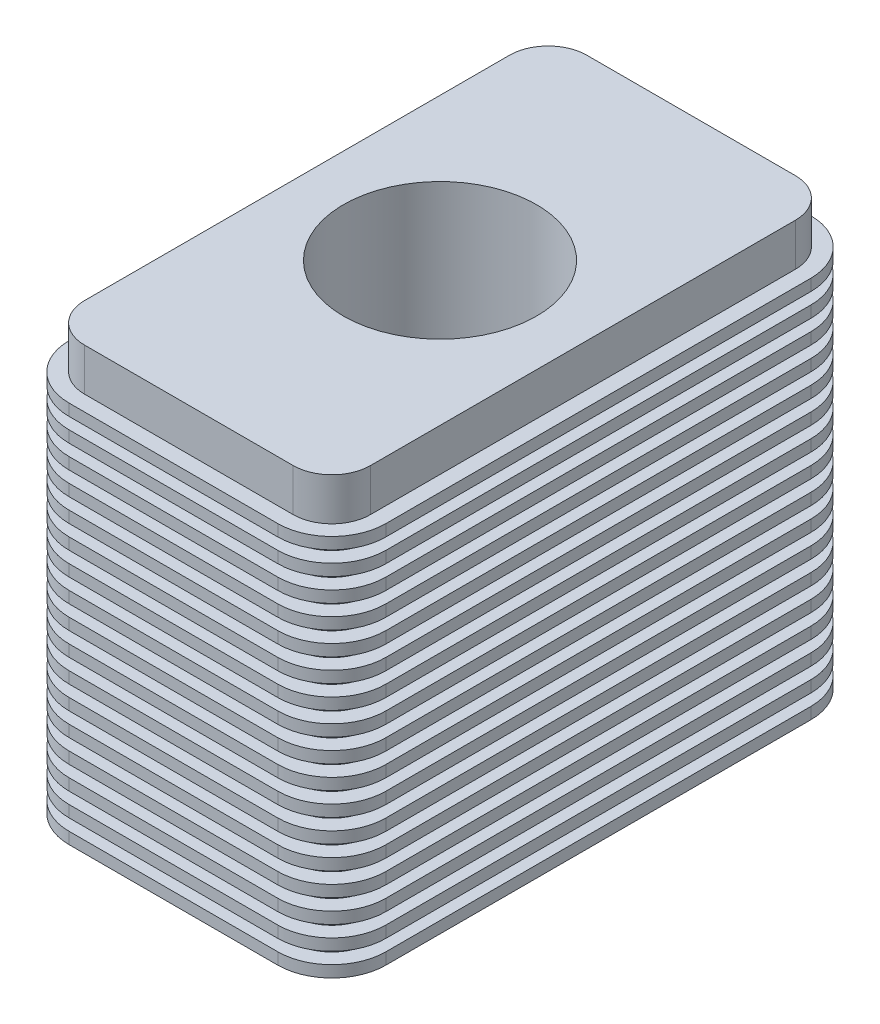
from build123d import *
from build123d.topology import SkipClean

# Parameters (mm, degrees)
BOSS_EXTRUDE1_DEPTH   = 110
BOSS_EXTRUDE3_DEPTH   = 3
LPATTERN1_COUNT       = 17
LPATTERN1_PITCH       = 6
MIRROR1_COPY_1_DEPTH  = 3
MIRROR1_COPY_2_DEPTH  = 3
MIRROR1_COPY_3_DEPTH  = 3
MIRROR1_COPY_4_DEPTH  = 3
MIRROR1_COPY_5_DEPTH  = 3
MIRROR1_COPY_6_DEPTH  = 3
MIRROR1_COPY_7_DEPTH  = 3
MIRROR1_COPY_8_DEPTH  = 3
MIRROR1_COPY_9_DEPTH  = 3
MIRROR1_COPY_10_DEPTH = 3
MIRROR1_COPY_11_DEPTH = 3
MIRROR1_COPY_12_DEPTH = 3
MIRROR1_COPY_13_DEPTH = 3
MIRROR1_COPY_14_DEPTH = 3
MIRROR1_COPY_15_DEPTH = 3
MIRROR1_COPY_16_DEPTH = 3


with BuildPart() as part:
    # Sketch1 → Boss-Extrude1 (new body)
    with BuildSketch(Plane(origin=(0, 0, 0), x_dir=(1, 0, 0), z_dir=(0, 1, 0))):
        with BuildLine():
            Line((25, 0), (37, 0))
            Line((37, 0), (37, 55))
            ThreePointArc((37, 55), (34.071067812, 62.071067812), (27, 65))
            Line((27, 65), (-27, 65))
            ThreePointArc((-27, 65), (-34.071067812, 62.071067812), (-37, 55))
            Line((-37, 55), (-37, 0))
            Line((-37, 0), (-25, 0))
            ThreePointArc((-25, 0), (0, 25), (25, 0))
        make_face()
    boss_extrude1 = extrude(amount=BOSS_EXTRUDE1_DEPTH)


with BuildPart() as body_2:
    # Sketch3 → Boss-Extrude3 (new body)
    with BuildSketch(Plane(origin=(0, 0, 0), x_dir=(-1, 0, 0), z_dir=(0, -1, 0))):
        with BuildLine():
            Line((27, 69), (-27, 69))
            ThreePointArc((-27, 69), (-36.899494937, 64.899494937), (-41, 55))
            Line((-41, 55), (-41, 0))
            Line((-41, 0), (-37, 0))
            Line((-37, 0), (-37, 55))
            ThreePointArc((-37, 55), (-34.071067812, 62.071067812), (-27, 65))
            Line((-27, 65), (27, 65))
            ThreePointArc((27, 65), (34.071067812, 62.071067812), (37, 55))
            Line((37, 55), (37, 0))
            Line((37, 0), (41, 0))
            Line((41, 0), (41, 55))
            ThreePointArc((41, 55), (36.899494937, 64.899494937), (27, 69))
        make_face()
    boss_extrude3 = extrude(amount=-BOSS_EXTRUDE3_DEPTH)


    with SkipClean():  # the faces are left unmerged after this step: merging them gives an invalid solid
        add(part.part)  # Mirror1 merges part
        # Mirror1: Boss-Extrude1, Boss-Extrude3 across plane
        add(boss_extrude1.mirror(Plane.XY))
        add(boss_extrude3.mirror(Plane.XY))



with BuildPart() as lpattern1_1:
    # LPattern1: pattern copy
    add(boss_extrude3.moved(Location(Vector(0, 1, 0) * (1 * LPATTERN1_PITCH))))


with BuildPart() as lpattern1_2:
    # LPattern1: pattern copy
    add(boss_extrude3.moved(Location(Vector(0, 1, 0) * (2 * LPATTERN1_PITCH))))


with BuildPart() as lpattern1_3:
    # LPattern1: pattern copy
    add(boss_extrude3.moved(Location(Vector(0, 1, 0) * (3 * LPATTERN1_PITCH))))


with BuildPart() as lpattern1_4:
    # LPattern1: pattern copy
    add(boss_extrude3.moved(Location(Vector(0, 1, 0) * (4 * LPATTERN1_PITCH))))


with BuildPart() as lpattern1_5:
    # LPattern1: pattern copy
    add(boss_extrude3.moved(Location(Vector(0, 1, 0) * (5 * LPATTERN1_PITCH))))


with BuildPart() as lpattern1_6:
    # LPattern1: pattern copy
    add(boss_extrude3.moved(Location(Vector(0, 1, 0) * (6 * LPATTERN1_PITCH))))


with BuildPart() as lpattern1_7:
    # LPattern1: pattern copy
    add(boss_extrude3.moved(Location(Vector(0, 1, 0) * (7 * LPATTERN1_PITCH))))


with BuildPart() as lpattern1_8:
    # LPattern1: pattern copy
    add(boss_extrude3.moved(Location(Vector(0, 1, 0) * (8 * LPATTERN1_PITCH))))


with BuildPart() as lpattern1_9:
    # LPattern1: pattern copy
    add(boss_extrude3.moved(Location(Vector(0, 1, 0) * (9 * LPATTERN1_PITCH))))


with BuildPart() as lpattern1_10:
    # LPattern1: pattern copy
    add(boss_extrude3.moved(Location(Vector(0, 1, 0) * (10 * LPATTERN1_PITCH))))


with BuildPart() as lpattern1_11:
    # LPattern1: pattern copy
    add(boss_extrude3.moved(Location(Vector(0, 1, 0) * (11 * LPATTERN1_PITCH))))


with BuildPart() as lpattern1_12:
    # LPattern1: pattern copy
    add(boss_extrude3.moved(Location(Vector(0, 1, 0) * (12 * LPATTERN1_PITCH))))


with BuildPart() as lpattern1_13:
    # LPattern1: pattern copy
    add(boss_extrude3.moved(Location(Vector(0, 1, 0) * (13 * LPATTERN1_PITCH))))


with BuildPart() as lpattern1_14:
    # LPattern1: pattern copy
    add(boss_extrude3.moved(Location(Vector(0, 1, 0) * (14 * LPATTERN1_PITCH))))


with BuildPart() as lpattern1_15:
    # LPattern1: pattern copy
    add(boss_extrude3.moved(Location(Vector(0, 1, 0) * (15 * LPATTERN1_PITCH))))


with BuildPart() as lpattern1_16:
    # LPattern1: pattern copy
    add(boss_extrude3.moved(Location(Vector(0, 1, 0) * (16 * LPATTERN1_PITCH))))


with BuildPart() as body_2_1:
    with SkipClean():  # the faces are left unmerged after this step: merging them gives an invalid solid
        add(body_2.part)

        add(lpattern1_1.part)  # Mirror1 copy 1 merges LPattern1_1
        # Mirror1 copy 1 sketch → Mirror1 copy 1 (add)
        with BuildSketch(Plane(origin=(0, 6, 0), x_dir=(-1, 0, 0), z_dir=(0, -1, 0))):
            with BuildLine():
                Line((27, -69), (-27, -69))
                ThreePointArc((-27, -69), (-36.899494937, -64.899494937), (-41, -55))
                Line((-41, -55), (-41, 0))
                Line((-41, 0), (-37, 0))
                Line((-37, 0), (-37, -55))
                ThreePointArc((-37, -55), (-34.071067812, -62.071067812), (-27, -65))
                Line((-27, -65), (27, -65))
                ThreePointArc((27, -65), (34.071067812, -62.071067812), (37, -55))
                Line((37, -55), (37, 0))
                Line((37, 0), (41, 0))
                Line((41, 0), (41, -55))
                ThreePointArc((41, -55), (36.899494937, -64.899494937), (27, -69))
            make_face()
        extrude(amount=-MIRROR1_COPY_1_DEPTH)


    with SkipClean():  # the faces are left unmerged after this step: merging them gives an invalid solid
        add(lpattern1_2.part)  # Mirror1 copy 2 merges LPattern1_2
        # Mirror1 copy 2 sketch → Mirror1 copy 2 (add)
        with BuildSketch(Plane(origin=(0, 12, 0), x_dir=(-1, 0, 0), z_dir=(0, -1, 0))):
            with BuildLine():
                Line((27, -69), (-27, -69))
                ThreePointArc((-27, -69), (-36.899494937, -64.899494937), (-41, -55))
                Line((-41, -55), (-41, 0))
                Line((-41, 0), (-37, 0))
                Line((-37, 0), (-37, -55))
                ThreePointArc((-37, -55), (-34.071067812, -62.071067812), (-27, -65))
                Line((-27, -65), (27, -65))
                ThreePointArc((27, -65), (34.071067812, -62.071067812), (37, -55))
                Line((37, -55), (37, 0))
                Line((37, 0), (41, 0))
                Line((41, 0), (41, -55))
                ThreePointArc((41, -55), (36.899494937, -64.899494937), (27, -69))
            make_face()
        extrude(amount=-MIRROR1_COPY_2_DEPTH)


    with SkipClean():  # the faces are left unmerged after this step: merging them gives an invalid solid
        add(lpattern1_3.part)  # Mirror1 copy 3 merges LPattern1_3
        # Mirror1 copy 3 sketch → Mirror1 copy 3 (add)
        with BuildSketch(Plane(origin=(0, 18, 0), x_dir=(-1, 0, 0), z_dir=(0, -1, 0))):
            with BuildLine():
                Line((27, -69), (-27, -69))
                ThreePointArc((-27, -69), (-36.899494937, -64.899494937), (-41, -55))
                Line((-41, -55), (-41, 0))
                Line((-41, 0), (-37, 0))
                Line((-37, 0), (-37, -55))
                ThreePointArc((-37, -55), (-34.071067812, -62.071067812), (-27, -65))
                Line((-27, -65), (27, -65))
                ThreePointArc((27, -65), (34.071067812, -62.071067812), (37, -55))
                Line((37, -55), (37, 0))
                Line((37, 0), (41, 0))
                Line((41, 0), (41, -55))
                ThreePointArc((41, -55), (36.899494937, -64.899494937), (27, -69))
            make_face()
        extrude(amount=-MIRROR1_COPY_3_DEPTH)


    with SkipClean():  # the faces are left unmerged after this step: merging them gives an invalid solid
        add(lpattern1_4.part)  # Mirror1 copy 4 merges LPattern1_4
        # Mirror1 copy 4 sketch → Mirror1 copy 4 (add)
        with BuildSketch(Plane(origin=(0, 24, 0), x_dir=(-1, 0, 0), z_dir=(0, -1, 0))):
            with BuildLine():
                Line((27, -69), (-27, -69))
                ThreePointArc((-27, -69), (-36.899494937, -64.899494937), (-41, -55))
                Line((-41, -55), (-41, 0))
                Line((-41, 0), (-37, 0))
                Line((-37, 0), (-37, -55))
                ThreePointArc((-37, -55), (-34.071067812, -62.071067812), (-27, -65))
                Line((-27, -65), (27, -65))
                ThreePointArc((27, -65), (34.071067812, -62.071067812), (37, -55))
                Line((37, -55), (37, 0))
                Line((37, 0), (41, 0))
                Line((41, 0), (41, -55))
                ThreePointArc((41, -55), (36.899494937, -64.899494937), (27, -69))
            make_face()
        extrude(amount=-MIRROR1_COPY_4_DEPTH)


    with SkipClean():  # the faces are left unmerged after this step: merging them gives an invalid solid
        add(lpattern1_5.part)  # Mirror1 copy 5 merges LPattern1_5
        # Mirror1 copy 5 sketch → Mirror1 copy 5 (add)
        with BuildSketch(Plane(origin=(0, 30, 0), x_dir=(-1, 0, 0), z_dir=(0, -1, 0))):
            with BuildLine():
                Line((27, -69), (-27, -69))
                ThreePointArc((-27, -69), (-36.899494937, -64.899494937), (-41, -55))
                Line((-41, -55), (-41, 0))
                Line((-41, 0), (-37, 0))
                Line((-37, 0), (-37, -55))
                ThreePointArc((-37, -55), (-34.071067812, -62.071067812), (-27, -65))
                Line((-27, -65), (27, -65))
                ThreePointArc((27, -65), (34.071067812, -62.071067812), (37, -55))
                Line((37, -55), (37, 0))
                Line((37, 0), (41, 0))
                Line((41, 0), (41, -55))
                ThreePointArc((41, -55), (36.899494937, -64.899494937), (27, -69))
            make_face()
        extrude(amount=-MIRROR1_COPY_5_DEPTH)


    with SkipClean():  # the faces are left unmerged after this step: merging them gives an invalid solid
        add(lpattern1_6.part)  # Mirror1 copy 6 merges LPattern1_6
        # Mirror1 copy 6 sketch → Mirror1 copy 6 (add)
        with BuildSketch(Plane(origin=(0, 36, 0), x_dir=(-1, 0, 0), z_dir=(0, -1, 0))):
            with BuildLine():
                Line((27, -69), (-27, -69))
                ThreePointArc((-27, -69), (-36.899494937, -64.899494937), (-41, -55))
                Line((-41, -55), (-41, 0))
                Line((-41, 0), (-37, 0))
                Line((-37, 0), (-37, -55))
                ThreePointArc((-37, -55), (-34.071067812, -62.071067812), (-27, -65))
                Line((-27, -65), (27, -65))
                ThreePointArc((27, -65), (34.071067812, -62.071067812), (37, -55))
                Line((37, -55), (37, 0))
                Line((37, 0), (41, 0))
                Line((41, 0), (41, -55))
                ThreePointArc((41, -55), (36.899494937, -64.899494937), (27, -69))
            make_face()
        extrude(amount=-MIRROR1_COPY_6_DEPTH)


    with SkipClean():  # the faces are left unmerged after this step: merging them gives an invalid solid
        add(lpattern1_7.part)  # Mirror1 copy 7 merges LPattern1_7
        # Mirror1 copy 7 sketch → Mirror1 copy 7 (add)
        with BuildSketch(Plane(origin=(0, 42, 0), x_dir=(-1, 0, 0), z_dir=(0, -1, 0))):
            with BuildLine():
                Line((27, -69), (-27, -69))
                ThreePointArc((-27, -69), (-36.899494937, -64.899494937), (-41, -55))
                Line((-41, -55), (-41, 0))
                Line((-41, 0), (-37, 0))
                Line((-37, 0), (-37, -55))
                ThreePointArc((-37, -55), (-34.071067812, -62.071067812), (-27, -65))
                Line((-27, -65), (27, -65))
                ThreePointArc((27, -65), (34.071067812, -62.071067812), (37, -55))
                Line((37, -55), (37, 0))
                Line((37, 0), (41, 0))
                Line((41, 0), (41, -55))
                ThreePointArc((41, -55), (36.899494937, -64.899494937), (27, -69))
            make_face()
        extrude(amount=-MIRROR1_COPY_7_DEPTH)


    with SkipClean():  # the faces are left unmerged after this step: merging them gives an invalid solid
        add(lpattern1_8.part)  # Mirror1 copy 8 merges LPattern1_8
        # Mirror1 copy 8 sketch → Mirror1 copy 8 (add)
        with BuildSketch(Plane(origin=(0, 48, 0), x_dir=(-1, 0, 0), z_dir=(0, -1, 0))):
            with BuildLine():
                Line((27, -69), (-27, -69))
                ThreePointArc((-27, -69), (-36.899494937, -64.899494937), (-41, -55))
                Line((-41, -55), (-41, 0))
                Line((-41, 0), (-37, 0))
                Line((-37, 0), (-37, -55))
                ThreePointArc((-37, -55), (-34.071067812, -62.071067812), (-27, -65))
                Line((-27, -65), (27, -65))
                ThreePointArc((27, -65), (34.071067812, -62.071067812), (37, -55))
                Line((37, -55), (37, 0))
                Line((37, 0), (41, 0))
                Line((41, 0), (41, -55))
                ThreePointArc((41, -55), (36.899494937, -64.899494937), (27, -69))
            make_face()
        extrude(amount=-MIRROR1_COPY_8_DEPTH)


    with SkipClean():  # the faces are left unmerged after this step: merging them gives an invalid solid
        add(lpattern1_9.part)  # Mirror1 copy 9 merges LPattern1_9
        # Mirror1 copy 9 sketch → Mirror1 copy 9 (add)
        with BuildSketch(Plane(origin=(0, 54, 0), x_dir=(-1, 0, 0), z_dir=(0, -1, 0))):
            with BuildLine():
                Line((27, -69), (-27, -69))
                ThreePointArc((-27, -69), (-36.899494937, -64.899494937), (-41, -55))
                Line((-41, -55), (-41, 0))
                Line((-41, 0), (-37, 0))
                Line((-37, 0), (-37, -55))
                ThreePointArc((-37, -55), (-34.071067812, -62.071067812), (-27, -65))
                Line((-27, -65), (27, -65))
                ThreePointArc((27, -65), (34.071067812, -62.071067812), (37, -55))
                Line((37, -55), (37, 0))
                Line((37, 0), (41, 0))
                Line((41, 0), (41, -55))
                ThreePointArc((41, -55), (36.899494937, -64.899494937), (27, -69))
            make_face()
        extrude(amount=-MIRROR1_COPY_9_DEPTH)


    with SkipClean():  # the faces are left unmerged after this step: merging them gives an invalid solid
        add(lpattern1_10.part)  # Mirror1 copy 10 merges LPattern1_10
        # Mirror1 copy 10 sketch → Mirror1 copy 10 (add)
        with BuildSketch(Plane(origin=(0, 60, 0), x_dir=(-1, 0, 0), z_dir=(0, -1, 0))):
            with BuildLine():
                Line((27, -69), (-27, -69))
                ThreePointArc((-27, -69), (-36.899494937, -64.899494937), (-41, -55))
                Line((-41, -55), (-41, 0))
                Line((-41, 0), (-37, 0))
                Line((-37, 0), (-37, -55))
                ThreePointArc((-37, -55), (-34.071067812, -62.071067812), (-27, -65))
                Line((-27, -65), (27, -65))
                ThreePointArc((27, -65), (34.071067812, -62.071067812), (37, -55))
                Line((37, -55), (37, 0))
                Line((37, 0), (41, 0))
                Line((41, 0), (41, -55))
                ThreePointArc((41, -55), (36.899494937, -64.899494937), (27, -69))
            make_face()
        extrude(amount=-MIRROR1_COPY_10_DEPTH)


    with SkipClean():  # the faces are left unmerged after this step: merging them gives an invalid solid
        add(lpattern1_11.part)  # Mirror1 copy 11 merges LPattern1_11
        # Mirror1 copy 11 sketch → Mirror1 copy 11 (add)
        with BuildSketch(Plane(origin=(0, 66, 0), x_dir=(-1, 0, 0), z_dir=(0, -1, 0))):
            with BuildLine():
                Line((27, -69), (-27, -69))
                ThreePointArc((-27, -69), (-36.899494937, -64.899494937), (-41, -55))
                Line((-41, -55), (-41, 0))
                Line((-41, 0), (-37, 0))
                Line((-37, 0), (-37, -55))
                ThreePointArc((-37, -55), (-34.071067812, -62.071067812), (-27, -65))
                Line((-27, -65), (27, -65))
                ThreePointArc((27, -65), (34.071067812, -62.071067812), (37, -55))
                Line((37, -55), (37, 0))
                Line((37, 0), (41, 0))
                Line((41, 0), (41, -55))
                ThreePointArc((41, -55), (36.899494937, -64.899494937), (27, -69))
            make_face()
        extrude(amount=-MIRROR1_COPY_11_DEPTH)


    with SkipClean():  # the faces are left unmerged after this step: merging them gives an invalid solid
        add(lpattern1_12.part)  # Mirror1 copy 12 merges LPattern1_12
        # Mirror1 copy 12 sketch → Mirror1 copy 12 (add)
        with BuildSketch(Plane(origin=(0, 72, 0), x_dir=(-1, 0, 0), z_dir=(0, -1, 0))):
            with BuildLine():
                Line((27, -69), (-27, -69))
                ThreePointArc((-27, -69), (-36.899494937, -64.899494937), (-41, -55))
                Line((-41, -55), (-41, 0))
                Line((-41, 0), (-37, 0))
                Line((-37, 0), (-37, -55))
                ThreePointArc((-37, -55), (-34.071067812, -62.071067812), (-27, -65))
                Line((-27, -65), (27, -65))
                ThreePointArc((27, -65), (34.071067812, -62.071067812), (37, -55))
                Line((37, -55), (37, 0))
                Line((37, 0), (41, 0))
                Line((41, 0), (41, -55))
                ThreePointArc((41, -55), (36.899494937, -64.899494937), (27, -69))
            make_face()
        extrude(amount=-MIRROR1_COPY_12_DEPTH)


    with SkipClean():  # the faces are left unmerged after this step: merging them gives an invalid solid
        add(lpattern1_13.part)  # Mirror1 copy 13 merges LPattern1_13
        # Mirror1 copy 13 sketch → Mirror1 copy 13 (add)
        with BuildSketch(Plane(origin=(0, 78, 0), x_dir=(-1, 0, 0), z_dir=(0, -1, 0))):
            with BuildLine():
                Line((27, -69), (-27, -69))
                ThreePointArc((-27, -69), (-36.899494937, -64.899494937), (-41, -55))
                Line((-41, -55), (-41, 0))
                Line((-41, 0), (-37, 0))
                Line((-37, 0), (-37, -55))
                ThreePointArc((-37, -55), (-34.071067812, -62.071067812), (-27, -65))
                Line((-27, -65), (27, -65))
                ThreePointArc((27, -65), (34.071067812, -62.071067812), (37, -55))
                Line((37, -55), (37, 0))
                Line((37, 0), (41, 0))
                Line((41, 0), (41, -55))
                ThreePointArc((41, -55), (36.899494937, -64.899494937), (27, -69))
            make_face()
        extrude(amount=-MIRROR1_COPY_13_DEPTH)


    with SkipClean():  # the faces are left unmerged after this step: merging them gives an invalid solid
        add(lpattern1_14.part)  # Mirror1 copy 14 merges LPattern1_14
        # Mirror1 copy 14 sketch → Mirror1 copy 14 (add)
        with BuildSketch(Plane(origin=(0, 84, 0), x_dir=(-1, 0, 0), z_dir=(0, -1, 0))):
            with BuildLine():
                Line((27, -69), (-27, -69))
                ThreePointArc((-27, -69), (-36.899494937, -64.899494937), (-41, -55))
                Line((-41, -55), (-41, 0))
                Line((-41, 0), (-37, 0))
                Line((-37, 0), (-37, -55))
                ThreePointArc((-37, -55), (-34.071067812, -62.071067812), (-27, -65))
                Line((-27, -65), (27, -65))
                ThreePointArc((27, -65), (34.071067812, -62.071067812), (37, -55))
                Line((37, -55), (37, 0))
                Line((37, 0), (41, 0))
                Line((41, 0), (41, -55))
                ThreePointArc((41, -55), (36.899494937, -64.899494937), (27, -69))
            make_face()
        extrude(amount=-MIRROR1_COPY_14_DEPTH)


    with SkipClean():  # the faces are left unmerged after this step: merging them gives an invalid solid
        add(lpattern1_15.part)  # Mirror1 copy 15 merges LPattern1_15
        # Mirror1 copy 15 sketch → Mirror1 copy 15 (add)
        with BuildSketch(Plane(origin=(0, 90, 0), x_dir=(-1, 0, 0), z_dir=(0, -1, 0))):
            with BuildLine():
                Line((27, -69), (-27, -69))
                ThreePointArc((-27, -69), (-36.899494937, -64.899494937), (-41, -55))
                Line((-41, -55), (-41, 0))
                Line((-41, 0), (-37, 0))
                Line((-37, 0), (-37, -55))
                ThreePointArc((-37, -55), (-34.071067812, -62.071067812), (-27, -65))
                Line((-27, -65), (27, -65))
                ThreePointArc((27, -65), (34.071067812, -62.071067812), (37, -55))
                Line((37, -55), (37, 0))
                Line((37, 0), (41, 0))
                Line((41, 0), (41, -55))
                ThreePointArc((41, -55), (36.899494937, -64.899494937), (27, -69))
            make_face()
        extrude(amount=-MIRROR1_COPY_15_DEPTH)


    with SkipClean():  # the faces are left unmerged after this step: merging them gives an invalid solid
        add(lpattern1_16.part)  # Mirror1 copy 16 merges LPattern1_16
        # Mirror1 copy 16 sketch → Mirror1 copy 16 (add)
        with BuildSketch(Plane(origin=(0, 96, 0), x_dir=(-1, 0, 0), z_dir=(0, -1, 0))):
            with BuildLine():
                Line((27, -69), (-27, -69))
                ThreePointArc((-27, -69), (-36.899494937, -64.899494937), (-41, -55))
                Line((-41, -55), (-41, 0))
                Line((-41, 0), (-37, 0))
                Line((-37, 0), (-37, -55))
                ThreePointArc((-37, -55), (-34.071067812, -62.071067812), (-27, -65))
                Line((-27, -65), (27, -65))
                ThreePointArc((27, -65), (34.071067812, -62.071067812), (37, -55))
                Line((37, -55), (37, 0))
                Line((37, 0), (41, 0))
                Line((41, 0), (41, -55))
                ThreePointArc((41, -55), (36.899494937, -64.899494937), (27, -69))
            make_face()
        extrude(amount=-MIRROR1_COPY_16_DEPTH)


solid = body_2_1.part
